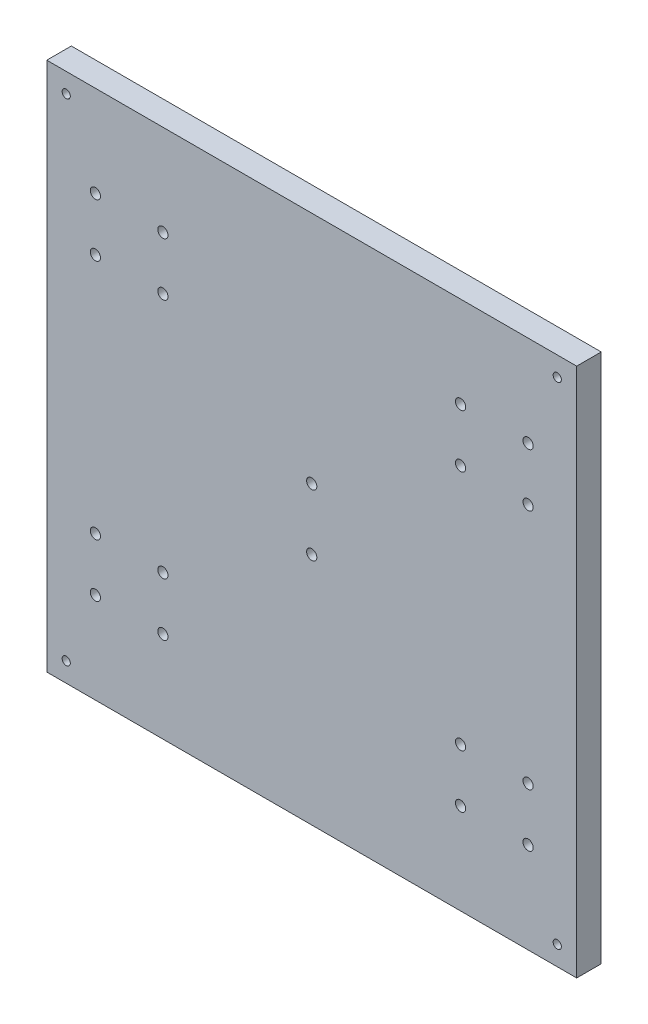
from build123d import *

# Parameters (mm, degrees)
IZIM1_W                     = 320
IZIM1_H                     = 320
IZIM1_R                     = 2.5
IZIM1_R_2                   = 2
Y_KSEKLIK_EKSTR_ZYON1_DEPTH = 12
SKETCH2_W                   = 320
SKETCH2_H                   = 320
SKETCH2_W_2                 = 310
SKETCH2_H_2                 = 310
CUT_EXTRUDE1_DEPTH          = 10
SKETCH3_OUTSIDE_W           = 412.542
SKETCH3_OUTSIDE_H           = 412.542
SKETCH3_OUTSIDE_W_2         = 259
SKETCH3_OUTSIDE_H_2         = 259
CUT_EXTRUDE2_DEPTH          = 227.592144612
SKETCH4_R                   = 2.5
CUT_EXTRUDE3_DEPTH          = 184.533375711


with BuildPart() as part:
    # Çizim1 → Yükseklik-Ekstrüzyon1 (new body)
    with BuildSketch(Plane.XY):
        Rectangle(IZIM1_W, IZIM1_H)
        with Locations((-105.75, 85)):
            Circle(IZIM1_R, mode=Mode.SUBTRACT)
        with Locations((-72.75, 85)):
            Circle(IZIM1_R, mode=Mode.SUBTRACT)
        with Locations((-105.75, 59)):
            Circle(IZIM1_R, mode=Mode.SUBTRACT)
        with Locations((-72.75, 59)):
            Circle(IZIM1_R, mode=Mode.SUBTRACT)
        with Locations((-120, 120)):
            Circle(IZIM1_R_2, mode=Mode.SUBTRACT)
        with Locations(Location((-105.75, -59, 0), (0, 0, 180))):
            Circle(IZIM1_R, mode=Mode.SUBTRACT)
        with Locations(Location((-105.75, -85, 0), (0, 0, 180))):
            Circle(IZIM1_R, mode=Mode.SUBTRACT)
        with Locations(Location((-120, -120, 0), (0, 0, 180))):
            Circle(IZIM1_R_2, mode=Mode.SUBTRACT)
        with Locations(Location((-72.75, -59, 0), (0, 0, 180))):
            Circle(IZIM1_R, mode=Mode.SUBTRACT)
        with Locations(Location((-72.75, -85, 0), (0, 0, 180))):
            Circle(IZIM1_R, mode=Mode.SUBTRACT)
        with Locations((72.75, -85)):
            Circle(IZIM1_R, mode=Mode.SUBTRACT)
        with Locations((72.75, -59)):
            Circle(IZIM1_R, mode=Mode.SUBTRACT)
        with Locations((120, -120)):
            Circle(IZIM1_R_2, mode=Mode.SUBTRACT)
        with Locations((105.75, -85)):
            Circle(IZIM1_R, mode=Mode.SUBTRACT)
        with Locations((105.75, -59)):
            Circle(IZIM1_R, mode=Mode.SUBTRACT)
        with Locations(Location((120, 120, 0), (0, 0, 180))):
            Circle(IZIM1_R_2, mode=Mode.SUBTRACT)
        with Locations(Location((72.75, 59, 0), (0, 0, 180))):
            Circle(IZIM1_R, mode=Mode.SUBTRACT)
        with Locations(Location((105.75, 59, 0), (0, 0, 180))):
            Circle(IZIM1_R, mode=Mode.SUBTRACT)
        with Locations(Location((72.75, 85, 0), (0, 0, 180))):
            Circle(IZIM1_R, mode=Mode.SUBTRACT)
        with Locations(Location((105.75, 85, 0), (0, 0, 180))):
            Circle(IZIM1_R, mode=Mode.SUBTRACT)
    extrude(amount=Y_KSEKLIK_EKSTR_ZYON1_DEPTH)

    # Sketch2 → Cut-Extrude1 (cut)
    with BuildSketch(Plane.XY.offset(12)):
        Rectangle(SKETCH2_W, SKETCH2_H)
        Rectangle(SKETCH2_W_2, SKETCH2_H_2, mode=Mode.SUBTRACT)
    extrude(amount=-CUT_EXTRUDE1_DEPTH, mode=Mode.SUBTRACT)

    # Sketch3 outside → Cut-Extrude2 (cut, through all)
    with BuildSketch(Plane.XY.offset(12)):
        Rectangle(SKETCH3_OUTSIDE_W, SKETCH3_OUTSIDE_H)
        Rectangle(SKETCH3_OUTSIDE_W_2, SKETCH3_OUTSIDE_H_2, mode=Mode.SUBTRACT)
    extrude(amount=-CUT_EXTRUDE2_DEPTH, mode=Mode.SUBTRACT)

    # Sketch4 → Cut-Extrude3 (cut, through all)
    with BuildSketch(Plane.XY.offset(12)):
        with Locations((0, 15)):
            Circle(SKETCH4_R)
        with Locations((0, -15)):
            Circle(SKETCH4_R)
    extrude(amount=-CUT_EXTRUDE3_DEPTH, mode=Mode.SUBTRACT)


solid = part.part
